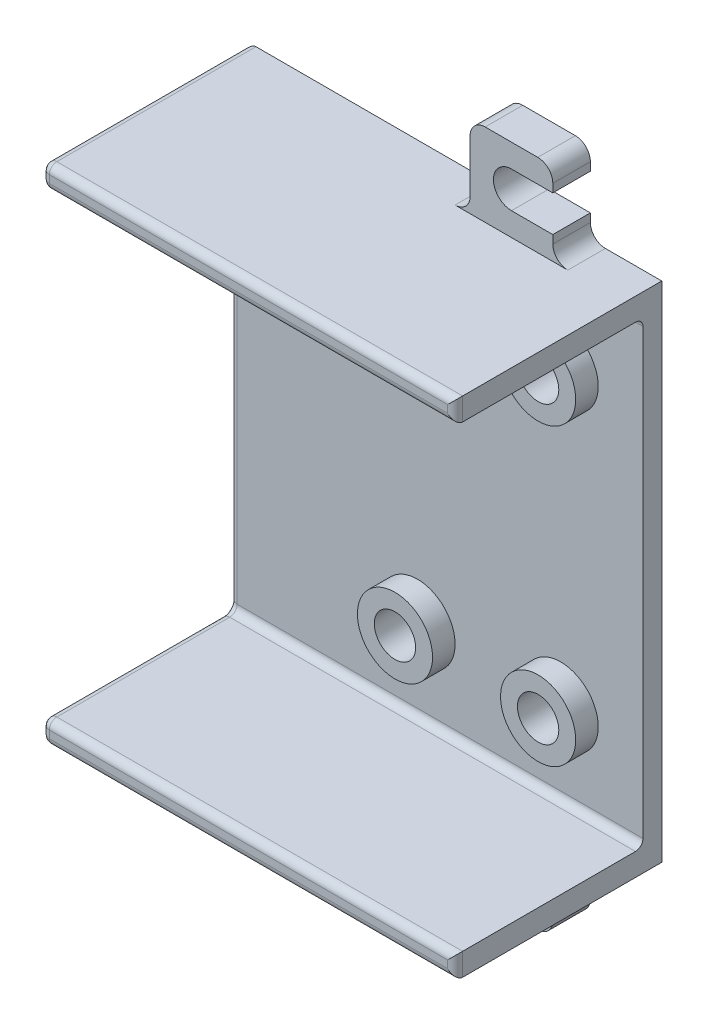
from build123d import *

# Parameters (mm, degrees)
SKETCH1_W            = 55
SKETCH1_H            = 67
BOSS_EXTRUDE1_DEPTH  = 2.5
SKETCH2_W            = 55
SKETCH2_H            = 3
BOSS_EXTRUDE2_DEPTH  = 25
SKETCH3_R            = 5
SKETCH3_R_2          = 2.75
BOSS_EXTRUDE3_DEPTH  = 3
CUT_EXTRUDE1_START   = -2
SKETCH4_R            = 2.75
CUT_EXTRUDE1_DEPTH   = 2
SKETCH5_W            = 5.5
SKETCH5_H            = 11
BOSS_EXTRUDE4_DEPTH  = 5
M4_CLEARANCE_HOLE1_D = 4.8
FILLET3_R            = 2
FILLET4_R            = 1
CUT_EXTRUDE3_DEPTH   = 57.945149047


with BuildPart() as part:
    # Sketch1 → Boss-Extrude1 (new body)
    with BuildSketch(Plane.XY):
        Rectangle(SKETCH1_W, SKETCH1_H)
    extrude(amount=BOSS_EXTRUDE1_DEPTH)

    # Sketch2 → Boss-Extrude2 (add)
    with BuildSketch(Plane.XY.offset(2.5)):
        with Locations((0, 32)):
            Rectangle(SKETCH2_W, SKETCH2_H)
        with Locations((0, -32)):
            Rectangle(SKETCH2_W, SKETCH2_H)
    extrude(amount=BOSS_EXTRUDE2_DEPTH)

    # Sketch3 → Boss-Extrude3 (add)
    # profile 1 of 4: a face of its own
    with BuildSketch(Plane.XY.offset(2.5)):
        with Locations((-2.504, 19.6215)):
            Circle(SKETCH3_R)
        with Locations((-2.504, 19.6215)):
            Circle(SKETCH3_R_2, mode=Mode.SUBTRACT)
    # profile 2 of 4: a face of its own
    with BuildSketch(Plane.XY.offset(2.5)):
        with Locations((16.546, 19.6215)):
            Circle(SKETCH3_R)
        with Locations((16.546, 19.6215)):
            Circle(SKETCH3_R_2, mode=Mode.SUBTRACT)
    # profile 3 of 4: a face of its own
    with BuildSketch(Plane.XY.offset(2.5)):
        with Locations((16.546, -19.6215)):
            Circle(SKETCH3_R)
        with Locations((16.546, -19.6215)):
            Circle(SKETCH3_R_2, mode=Mode.SUBTRACT)
    # profile 4 of 4: a face of its own
    with BuildSketch(Plane.XY.offset(2.5)):
        with Locations((-2.504, -19.6215)):
            Circle(SKETCH3_R)
        with Locations((-2.504, -19.6215)):
            Circle(SKETCH3_R_2, mode=Mode.SUBTRACT)
    extrude(amount=BOSS_EXTRUDE3_DEPTH)

    # Sketch4 → Cut-Extrude1 (cut)
    with BuildSketch(Plane.XY.offset(2.5).offset(CUT_EXTRUDE1_START)):
        with Locations((16.546, -19.6215)):
            Circle(SKETCH4_R)
        with Locations((-2.504, -19.6215)):
            Circle(SKETCH4_R)
        with Locations((16.546, 19.6215)):
            Circle(SKETCH4_R)
        with Locations((-2.504, 19.6215)):
            Circle(SKETCH4_R)
    extrude(amount=CUT_EXTRUDE1_DEPTH, mode=Mode.SUBTRACT)

    # Sketch5 → Boss-Extrude4 (add)
    with BuildSketch(Plane(origin=(0, 0, 0), x_dir=(-1, 0, 0), z_dir=(0, 0, -1))):
        with Locations((-9.75, 39)):
            Rectangle(SKETCH5_W, SKETCH5_H)
        with Locations((-15.25, 39)):
            Rectangle(SKETCH5_W, SKETCH5_H)
    boss_extrude4 = extrude(amount=-BOSS_EXTRUDE4_DEPTH)

    # M4 Clearance Hole1 (through all)
    with Locations(Plane.XY.offset(5)):
        with Locations((12.5, 39)):
            m4_clearance_hole1 = Hole(M4_CLEARANCE_HOLE1_D / 2)

    # Mirror2: Boss-Extrude4, M4 Clearance Hole1 across plane
    add(boss_extrude4.mirror(Plane.ZX))
    add(m4_clearance_hole1.mirror(Plane.ZX), mode=Mode.SUBTRACT)

    # Fillet3
    fillet3_edges = [part.edges().sort_by_distance(p)[0] for p in [
        (7, -44.5, 2.5),
        (18, -44.5, 2.5),
        (18, -33.5, 2.5),
        (7, -33.5, 2.5),
        (18, 44.5, 2.5),
        (7, 44.5, 2.5),
        (7, 33.5, 2.5),
        (18, 33.5, 2.5),
    ]]
    fillet(fillet3_edges, radius=FILLET3_R)

    # Fillet4
    fillet4_edges = [part.edges().sort_by_distance(p)[0] for p in [
        (-27.5, 0, 2.5),
        (0, 30.5, 2.5),
        (-27.5, 30.5, 15),
        (-27.5, 32, 27.5),
        (0, 30.5, 27.5),
        (27.5, 32, 27.5),
        (0, 33.5, 27.5),
        (0, -30.5, 2.5),
        (-27.5, -30.5, 15),
        (27.5, -32, 27.5),
        (0, -30.5, 27.5),
        (-27.5, -32, 27.5),
        (0, -33.5, 27.5),
        (-27.5, 0, 0),
        (-27.5, -33.5, 13.75),
        (-27.5, 33.5, 13.75),
    ]]
    fillet(fillet4_edges, radius=FILLET4_R)

    # Sketch10 → Cut-Extrude3 (cut, through all)
    with BuildSketch(Plane.XY.offset(5)):
        with BuildLine():
            Line((18, 41.4), (12.5, 41.4))
            ThreePointArc((12.5, 41.4), (14.197056275, 40.697056275), (14.9, 39))
            ThreePointArc((14.9, 39), (14.197056275, 37.302943725), (12.5, 36.6))
            Line((12.5, 36.6), (18, 36.6))
            Line((18, 36.6), (18, 41.4))
        make_face()
    cut_extrude3 = extrude(amount=-CUT_EXTRUDE3_DEPTH, mode=Mode.SUBTRACT)

    # Mirror3: Cut-Extrude3 across plane
    add(cut_extrude3.mirror(Plane.ZX), mode=Mode.SUBTRACT)


solid = part.part
